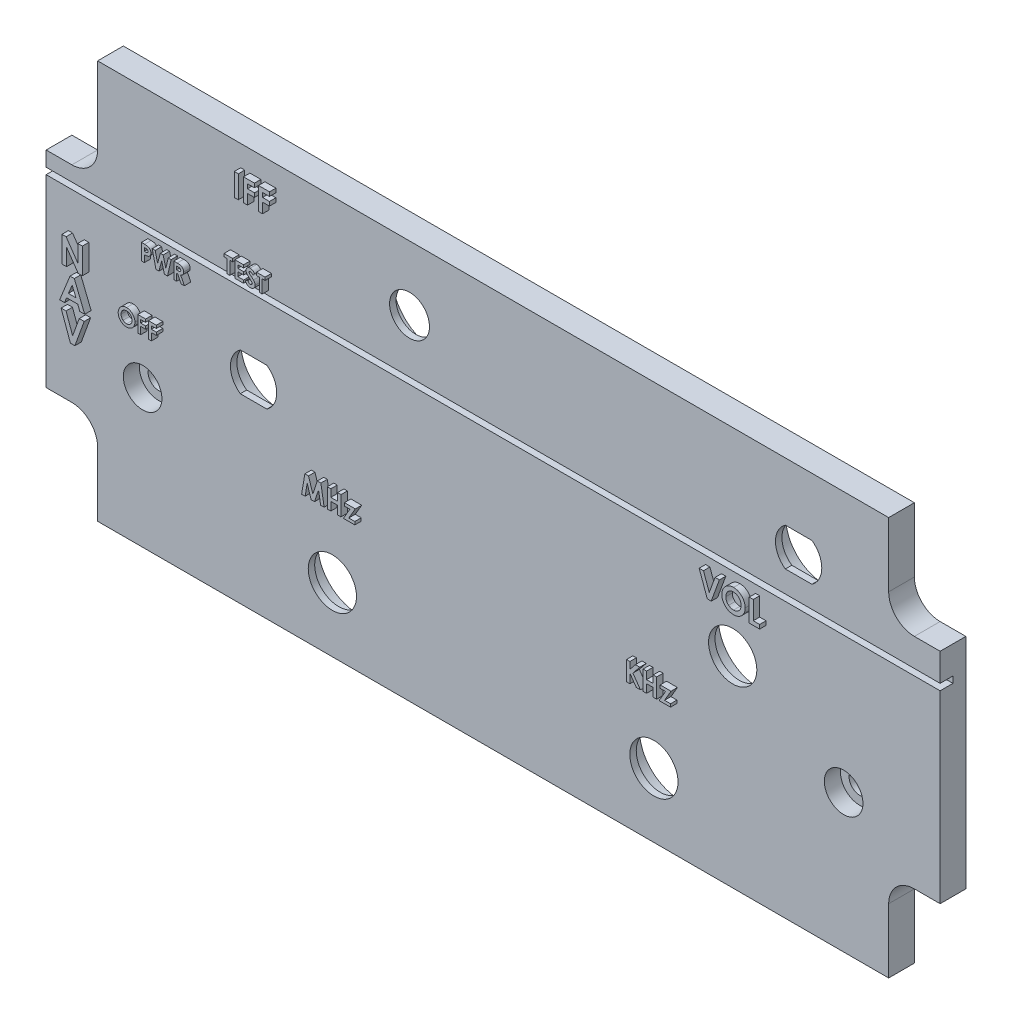
from build123d import *

# Parameters (mm, degrees)
SKETCH1_R           = 1.65
SKETCH1_R_2         = 3.75
SKETCH1_R_3         = 3.1
BOSS_EXTRUDE1_DEPTH = 4
SKETCH2_R           = 6.25
SKETCH2_R_2         = 3.75
SKETCH2_R_3         = 6.75
SKETCH2_R_4         = 3.1
SKETCH2_R_5         = 6
BACK_HOLES_DEPTH    = 3
SKETCH3_R           = 3
CUT_EXTRUDE2_DEPTH  = 2.5
SKETCH5_W           = 139
SKETCH5_H           = 1
CUT_EXTRUDE3_DEPTH  = 2
SKETCH4_W           = 0.628205128
SKETCH4_H           = 3.5
TEXTOS_DEPTH        = 1


with BuildPart() as part:
    # Sketch1 → Boss-Extrude1 (new body)
    with BuildSketch(Plane.XY):
        with BuildLine():
            Line((8, 0), (131, 0))
            Line((131, 0), (131, 10))
            ThreePointArc((131, 10), (132.171572875, 12.828427125), (135, 14))
            Line((135, 14), (139, 14))
            Line((139, 14), (139, 48))
            Line((139, 48), (135, 48))
            ThreePointArc((135, 48), (132.171572875, 49.171572875), (131, 52))
            Line((131, 52), (131, 62))
            Line((131, 62), (8, 62))
            Line((8, 62), (8, 50))
            ThreePointArc((8, 50), (6.828427125, 47.171572875), (4, 46))
            Line((4, 46), (0, 46))
            Line((0, 46), (0, 14))
            Line((0, 14), (4, 14))
            ThreePointArc((4, 14), (6.828427125, 12.828427125), (8, 10))
            Line((8, 10), (8, 0))
        make_face()
        with Locations((15, 21.5)):
            Circle(SKETCH1_R, mode=Mode.SUBTRACT)
        with Locations((124, 21.5)):
            Circle(SKETCH1_R, mode=Mode.SUBTRACT)
        with Locations((106.75, 31.217622393)):
            Circle(SKETCH1_R_2, mode=Mode.SUBTRACT)
        with Locations((94.5, 10)):
            Circle(SKETCH1_R_2, mode=Mode.SUBTRACT)
        with Locations((44.5, 10)):
            Circle(SKETCH1_R_2, mode=Mode.SUBTRACT)
        with Locations((56.5, 52)):
            Circle(SKETCH1_R_3, mode=Mode.SUBTRACT)
        with BuildLine():
            Line((30.186628972, 28.267622393), (34.313371028, 28.267622393))
            ThreePointArc((34.313371028, 28.267622393), (35.85, 31.217622393), (34.313371028, 34.167622393))
            Line((34.313371028, 34.167622393), (30.186628972, 34.167622393))
            ThreePointArc((30.186628972, 34.167622393), (28.65, 31.217622393), (30.186628972, 28.267622393))
        make_face(mode=Mode.SUBTRACT)
        with BuildLine():
            Line((114.936628972, 47.05), (119.063371028, 47.05))
            ThreePointArc((119.063371028, 47.05), (120.6, 50), (119.063371028, 52.95))
            Line((119.063371028, 52.95), (114.936628972, 52.95))
            ThreePointArc((114.936628972, 52.95), (113.4, 50), (114.936628972, 47.05))
        make_face(mode=Mode.SUBTRACT)
    extrude(amount=BOSS_EXTRUDE1_DEPTH)

    # Sketch2 → Back holes (cut)
    # profile 1 of 6: a face of its own
    with BuildSketch(Plane(origin=(0, 0, 0), x_dir=(-1, 0, 0), z_dir=(0, 0, -1))):
        with Locations((-44.5, 10)):
            Circle(SKETCH2_R)
        with Locations((-44.5, 10)):
            Circle(SKETCH2_R_2, mode=Mode.SUBTRACT)
    # profile 2 of 6: a face of its own
    with BuildSketch(Plane(origin=(0, 0, 0), x_dir=(-1, 0, 0), z_dir=(0, 0, -1))):
        with Locations((-94.5, 10)):
            Circle(SKETCH2_R)
        with Locations((-94.5, 10)):
            Circle(SKETCH2_R_2, mode=Mode.SUBTRACT)
    # profile 3 of 6: a face of its own
    with BuildSketch(Plane(origin=(0, 0, 0), x_dir=(-1, 0, 0), z_dir=(0, 0, -1))):
        with Locations((-106.75, 31.217622393)):
            Circle(SKETCH2_R)
        with Locations((-106.75, 31.217622393)):
            Circle(SKETCH2_R_2, mode=Mode.SUBTRACT)
    # profile 4 of 6: a face of its own
    with BuildSketch(Plane(origin=(0, 0, 0), x_dir=(-1, 0, 0), z_dir=(0, 0, -1))):
        with Locations((-56.5, 52)):
            Circle(SKETCH2_R_3)
        with Locations((-56.5, 52)):
            Circle(SKETCH2_R_4, mode=Mode.SUBTRACT)
    # profile 5 of 6: a face of its own
    with BuildSketch(Plane(origin=(0, 0, 0), x_dir=(-1, 0, 0), z_dir=(0, 0, -1))):
        with Locations((-117, 50)):
            Circle(SKETCH2_R_5)
        with BuildLine():
            ThreePointArc((-119.063371028, 47.05), (-120.6, 50), (-119.063371028, 52.95))
            Line((-119.063371028, 52.95), (-114.936628972, 52.95))
            ThreePointArc((-114.936628972, 52.95), (-113.4, 50), (-114.936628972, 47.05))
            Line((-114.936628972, 47.05), (-119.063371028, 47.05))
        make_face(mode=Mode.SUBTRACT)
    # profile 6 of 6: a face of its own
    with BuildSketch(Plane(origin=(0, 0, 0), x_dir=(-1, 0, 0), z_dir=(0, 0, -1))):
        with Locations((-32.25, 31.217622393)):
            Circle(SKETCH2_R_5)
        with BuildLine():
            Line((-34.313371028, 34.167622393), (-30.186628972, 34.167622393))
            ThreePointArc((-30.186628972, 34.167622393), (-28.65, 31.217622393), (-30.186628972, 28.267622393))
            Line((-30.186628972, 28.267622393), (-34.313371028, 28.267622393))
            ThreePointArc((-34.313371028, 28.267622393), (-35.85, 31.217622393), (-34.313371028, 34.167622393))
        make_face(mode=Mode.SUBTRACT)
    extrude(amount=-BACK_HOLES_DEPTH, mode=Mode.SUBTRACT)

    # Sketch3 → Cut-Extrude2 (cut)
    with BuildSketch(Plane.XY.offset(4)):
        with Locations((15, 21.5)):
            Circle(SKETCH3_R)
        with Locations((124, 21.5)):
            Circle(SKETCH3_R)
    extrude(amount=-CUT_EXTRUDE2_DEPTH, mode=Mode.SUBTRACT)

    # Sketch5 → Cut-Extrude3 (cut)
    with BuildSketch(Plane.XY.offset(4)):
        with Locations((69.5, 43.174651963)):
            Rectangle(SKETCH5_W, SKETCH5_H)
    extrude(amount=-CUT_EXTRUDE3_DEPTH, mode=Mode.SUBTRACT)

    # Sketch4 → Textos (add)
    # profile 1 of 25: a face of its own
    with BuildSketch(Plane.XY.offset(4)):
        Polygon((3.456317208, 36.872484532), (4.102951824, 36.872484532), (5.91785567, 34.240272994), (5.91785567, 36.872484532), (6.635804388, 36.872484532), (6.635804388, 32.872484532), (5.98436208, 32.872484532), (4.174265926, 35.49668325), (4.174265926, 32.872484532), (3.456317208, 32.872484532), align=None)
    # profile 2 of 25: a face of its own
    with BuildSketch(Plane.XY.offset(4)):
        with BuildLine():
            add(Edge.make_bspline(
                [(13.505282568, 32.032467925), (13.548748132, 32.031342524), (13.634559, 32.029120727), (13.760755821, 32.010600314), (13.882369792, 31.980423958), (13.999345918, 31.938476639), (14.111391307, 31.883622212), (14.218901178, 31.817415836), (14.321490437, 31.738607905), (14.418107832, 31.649036877), (14.50739973, 31.551632296), (14.584771211, 31.446758948), (14.650750772, 31.337134205), (14.705434809, 31.222464326), (14.747086881, 31.101955167), (14.776315863, 30.976221165), (14.795094036, 30.845298091), (14.797253815, 30.756157323), (14.798351479, 30.710853342)],
                knots=[0, 0, 0, 0, 1.014329547, 2.002516266, 2.970391464, 3.935626869, 4.897733899, 5.877609409, 6.878433252, 7.912639331, 8.949961323, 9.958554974, 10.949718813, 11.932905612, 12.9188844, 13.919928257, 14.942845884, 16, 16, 16, 16], degree=3))
            add(Edge.make_bspline(
                [(14.798351479, 30.710853342), (14.797182514, 30.666059832), (14.794879033, 30.577792784), (14.777082471, 30.448076218), (14.747361269, 30.323689089), (14.706415648, 30.204349845), (14.652723373, 30.090636525), (14.588030485, 29.981823084), (14.510629863, 29.878919337), (14.423344609, 29.781980506), (14.32725112, 29.693987717), (14.225472861, 29.616444223), (14.11847978, 29.550736793), (14.006428482, 29.496895523), (13.889078677, 29.455111296), (13.766720235, 29.425629488), (13.639360726, 29.407712798), (13.552750083, 29.405424363), (13.508788177, 29.404262797)],
                knots=[0, 0, 0, 0, 1.051557043, 2.072126891, 3.067553643, 4.050577992, 5.02905126, 6.015227836, 7.017913613, 8.04756643, 9.074058332, 10.072836633, 11.047628519, 12.017157415, 12.98668631, 13.966869689, 14.968021931, 16, 16, 16, 16], degree=3))
            add(Edge.make_bspline(
                [(13.508788177, 29.404262797), (13.462809295, 29.405304779), (13.372467076, 29.407352131), (13.240250834, 29.426821516), (13.11357625, 29.456149212), (12.993507463, 29.499919224), (12.878821675, 29.554635419), (12.770361516, 29.622021694), (12.668163437, 29.701966688), (12.572813661, 29.792422979), (12.486426534, 29.891402002), (12.410172949, 29.995964563), (12.345851359, 30.105311894), (12.293459409, 30.219495175), (12.252155701, 30.337804782), (12.223020628, 30.460961255), (12.205809845, 30.588669222), (12.203412483, 30.675411026), (12.202197633, 30.719366963)],
                knots=[0, 0, 0, 0, 1.067978421, 2.098431617, 3.099715153, 4.085208694, 5.062210972, 6.048429807, 7.046490867, 8.072918869, 9.098532598, 10.095778865, 11.076610158, 12.041847152, 13.011192615, 13.984257998, 14.978533688, 16, 16, 16, 16], degree=3))
            add(Edge.make_bspline(
                [(12.202197633, 30.719366963), (12.202578923, 30.748938217), (12.203336675, 30.807706285), (12.212464595, 30.894797562), (12.225606177, 30.980188934), (12.245041952, 31.063539945), (12.268651452, 31.145438597), (12.299240894, 31.225122557), (12.334059957, 31.303443069), (12.374742754, 31.37947507), (12.419978091, 31.452519002), (12.46933387, 31.522230303), (12.522934198, 31.587766063), (12.580606408, 31.649556956), (12.642549247, 31.707196824), (12.707947922, 31.761501641), (12.778070786, 31.811028879), (12.851383068, 31.85698809), (12.927471453, 31.898548207), (13.00602619, 31.933922936), (13.085428897, 31.964815084), (13.166740287, 31.989196534), (13.249088964, 32.009054969), (13.333354657, 32.022187693), (13.418776072, 32.031315361), (13.476378637, 32.032082825), (13.505282568, 32.032467925)],
                knots=[0, 0, 0, 0, 1.034744296, 2.056386356, 3.06226378, 4.057406941, 5.050368692, 6.043467995, 7.042652155, 8.049140477, 9.059438543, 10.048523776, 11.036952808, 12.020949711, 13.004946614, 13.997082645, 14.994316842, 16.007702937, 17.024872941, 18.026463647, 19.021641123, 20.005082605, 20.995858141, 21.984425357, 22.988620895, 24, 24, 24, 24], degree=3))
        make_face()
        with BuildLine():
            add(Edge.make_bspline(
                [(13.49827135, 31.583749976), (13.469019032, 31.582965071), (13.41128666, 31.581415982), (13.326603785, 31.569614018), (13.245305235, 31.550764939), (13.167841678, 31.52346228), (13.093877383, 31.488712924), (13.023281232, 31.44663829), (12.957030837, 31.395792109), (12.894242813, 31.338904086), (12.837524165, 31.275517755), (12.78741145, 31.207588522), (12.745475179, 31.135229826), (12.710353289, 31.059113864), (12.68391429, 30.978384731), (12.665082584, 30.893674787), (12.653181649, 30.804838074), (12.651681521, 30.744278202), (12.650915581, 30.713357348)],
                knots=[0, 0, 0, 0, 1.033739768, 2.040188636, 3.016340934, 3.979330865, 4.937572243, 5.900995986, 6.878200029, 7.884839167, 8.891893314, 9.879764717, 10.863503415, 11.843163062, 12.837761627, 13.859916423, 14.907309254, 16, 16, 16, 16], degree=3))
            add(Edge.make_bspline(
                [(12.650915581, 30.713357348), (12.651931101, 30.679090086), (12.653921351, 30.611931931), (12.667924992, 30.513963424), (12.691883827, 30.421441892), (12.72647992, 30.334819845), (12.769388152, 30.253135409), (12.822673366, 30.177389744), (12.885472594, 30.10712932), (12.93385261, 30.066108357), (12.958407568, 30.045288438)],
                knots=[0, 0, 0, 0, 1.078454662, 2.113592447, 3.107694534, 4.079536787, 5.043276885, 6.005368276, 6.987637804, 8, 8, 8, 8], degree=3))
            add(Edge.make_bspline(
                [(12.958407568, 30.045288438), (12.978522767, 30.029907481), (13.018299966, 29.999492103), (13.081793036, 29.960508557), (13.147178396, 29.927095769), (13.21494946, 29.900098631), (13.284963099, 29.878863137), (13.357209712, 29.863992269), (13.431586932, 29.854659513), (13.481884294, 29.853544072), (13.507285774, 29.852980745)],
                knots=[0, 0, 0, 0, 1.023928204, 2.024787132, 3.009472467, 3.9914905, 4.972207045, 5.96565515, 6.972602802, 8, 8, 8, 8], degree=3))
            add(Edge.make_bspline(
                [(13.507285774, 29.852980745), (13.536035098, 29.853772306), (13.592600298, 29.855329726), (13.675706756, 29.866986402), (13.755325266, 29.886713705), (13.831950108, 29.913776856), (13.905360329, 29.94896252), (13.975197155, 29.992342178), (14.041583027, 30.043383182), (14.10429106, 30.101018269), (14.161609167, 30.164654298), (14.211617307, 30.232945859), (14.254886942, 30.304388285), (14.289278471, 30.379992734), (14.316762015, 30.459045536), (14.335367071, 30.541896798), (14.347368543, 30.628204977), (14.348869093, 30.686940743), (14.34963353, 30.716862957)],
                knots=[0, 0, 0, 0, 1.026359118, 2.019393844, 2.989460624, 3.950973911, 4.916101784, 5.890408035, 6.881132271, 7.902007068, 8.92769091, 9.933912415, 10.920395702, 11.90457117, 12.894218921, 13.903490204, 14.931958862, 16, 16, 16, 16], degree=3))
            add(Edge.make_bspline(
                [(14.34963353, 30.716862957), (14.348842643, 30.74661311), (14.347285904, 30.805171748), (14.335608712, 30.89125803), (14.316006514, 30.973743528), (14.288862095, 31.052762952), (14.25420011, 31.128393769), (14.211337049, 31.200370016), (14.160423313, 31.26862211), (14.102630679, 31.332684939), (14.039726949, 31.391554576), (13.972193509, 31.442642719), (13.901920022, 31.487036692), (13.827294069, 31.521813137), (13.749842437, 31.549519457), (13.66909251, 31.569922789), (13.584738444, 31.581333072), (13.527350629, 31.58293716), (13.49827135, 31.583749976)],
                knots=[0, 0, 0, 0, 1.055025985, 2.07665775, 3.074803781, 4.057872707, 5.035505728, 6.020516407, 7.023567878, 8.050795229, 9.077271434, 10.074415901, 11.050397877, 12.019801805, 12.988065821, 13.964604439, 14.968634123, 16, 16, 16, 16], degree=3))
        make_face(mode=Mode.SUBTRACT)
    # profile 3 of 25: a face of its own
    with BuildSketch(Plane.XY.offset(4)):
        Polygon((15.247069427, 31.968365361), (16.465018145, 31.968365361), (16.465018145, 31.519647412), (15.695787376, 31.519647412), (15.695787376, 31.038878181), (16.465018145, 31.038878181), (16.465018145, 30.590160233), (15.695787376, 30.590160233), (15.695787376, 29.468365361), (15.247069427, 29.468365361), align=None)
    # profile 4 of 25: a face of its own
    with BuildSketch(Plane.XY.offset(4)):
        Polygon((16.913736094, 31.968365361), (18.131684812, 31.968365361), (18.131684812, 31.519647412), (17.362454043, 31.519647412), (17.362454043, 31.038878181), (18.131684812, 31.038878181), (18.131684812, 30.590160233), (17.362454043, 30.590160233), (17.362454043, 29.468365361), (16.913736094, 29.468365361), align=None)
    # profile 5 of 25: a face of its own
    with BuildSketch(Plane.XY.offset(4)):
        with BuildLine():
            Line((15.809110504, 41.959185567), (16.309911786, 41.959185567))
            add(Edge.make_bspline(
                [(16.309911786, 41.959185567), (16.342633492, 41.959039097), (16.405760522, 41.958756527), (16.496794893, 41.95532999), (16.580778558, 41.949189426), (16.657692221, 41.941600661), (16.727504257, 41.930961506), (16.790302092, 41.918764549), (16.846098759, 41.903905105), (16.895523446, 41.886267152), (16.939880507, 41.865472693), (16.981856593, 41.84332511), (17.020503041, 41.816892752), (17.057770452, 41.789024384), (17.091528184, 41.757057754), (17.123882248, 41.723120286), (17.153462361, 41.685866048), (17.180405585, 41.645745993), (17.204847241, 41.603501368), (17.226201107, 41.559056652), (17.243522167, 41.512341517), (17.258052382, 41.463658155), (17.269723193, 41.413008689), (17.277491656, 41.360081619), (17.282768387, 41.305246504), (17.283233985, 41.267925689), (17.283469479, 41.249049349)],
                knots=[0, 0, 0, 0, 1.698747864, 3.27724071, 4.728299578, 6.070144658, 7.288476769, 8.393259625, 9.389771311, 10.283485332, 11.113357557, 11.931608583, 12.74405601, 13.541433047, 14.344816069, 15.154114104, 15.974336324, 16.810834471, 17.661136416, 18.50621059, 19.367396281, 20.244825668, 21.142564693, 22.063065223, 23.020325768, 24, 24, 24, 24], degree=3))
            add(Edge.make_bspline(
                [(17.283469479, 41.249049349), (17.28312875, 41.228166903), (17.282459175, 41.187130331), (17.275895185, 41.12697575), (17.264681815, 41.069623804), (17.250026528, 41.014590833), (17.229590773, 40.962782251), (17.206243882, 40.91296189), (17.177519801, 40.86652656), (17.144697946, 40.822895411), (17.108852736, 40.7817137), (17.069133207, 40.744170473), (17.02629643, 40.710009797), (16.980590373, 40.678873667), (16.931843441, 40.650824891), (16.880090807, 40.625600822), (16.824979075, 40.604008204), (16.786600923, 40.592715439), (16.767143357, 40.586990054)],
                knots=[0, 0, 0, 0, 1.102006807, 2.165578795, 3.188629044, 4.184801286, 5.166646146, 6.124351954, 7.085497154, 8.042432466, 9.003981491, 9.963833307, 10.922997304, 11.89326795, 12.880200226, 13.889073926, 14.929769137, 16, 16, 16, 16], degree=3))
            add(Edge.make_bspline(
                [(16.767143357, 40.586990054), (16.754327485, 40.583801444), (16.726564179, 40.576893889), (16.680623533, 40.569880986), (16.627681763, 40.563433054), (16.567567672, 40.557891836), (16.500246604, 40.554125099), (16.425783742, 40.551183445), (16.344145342, 40.549044559), (16.287377227, 40.548968662), (16.257828453, 40.548929157)],
                knots=[0, 0, 0, 0, 0.618981996, 1.340914327, 2.176866532, 3.120127938, 4.170906482, 5.338178032, 6.614476169, 8, 8, 8, 8], degree=3))
            Line((16.257828453, 40.548929157), (16.257828453, 39.459185567))
            Line((16.257828453, 39.459185567), (15.809110504, 39.459185567))
            Line((15.809110504, 39.459185567), (15.809110504, 41.959185567))
        make_face()
        with BuildLine():
            Line((16.257828453, 40.997647105), (16.416582459, 40.997647105))
            add(Edge.make_bspline(
                [(16.416582459, 40.997647105), (16.445470257, 40.997830276), (16.498624234, 40.998167314), (16.571213797, 41.003041072), (16.629548166, 41.010484284), (16.6756334, 41.021159572), (16.712022058, 41.037360736), (16.743404997, 41.056102431), (16.770322945, 41.07980079), (16.793629926, 41.10688022), (16.812263155, 41.137995842), (16.825184329, 41.172640999), (16.833577669, 41.210087759), (16.834352872, 41.236148226), (16.83475153, 41.24955015)],
                knots=[0, 0, 0, 0, 1.8619151, 3.425951444, 4.686033666, 5.651700536, 6.461346321, 7.243864085, 7.999046032, 8.762387399, 9.539336099, 10.322741239, 11.137448474, 12, 12, 12, 12], degree=3))
            add(Edge.make_bspline(
                [(16.83475153, 41.24955015), (16.834356973, 41.261259237), (16.833591437, 41.283977681), (16.827967603, 41.31676603), (16.819004829, 41.347331536), (16.806018113, 41.375354981), (16.789229366, 41.40078875), (16.768760485, 41.423622824), (16.744874127, 41.444346212), (16.726432462, 41.455315419), (16.717063229, 41.460888291)],
                knots=[0, 0, 0, 0, 1.102301479, 2.1387299, 3.123554645, 4.094223062, 5.036071848, 5.982632524, 6.975082478, 8, 8, 8, 8], degree=3))
            add(Edge.make_bspline(
                [(16.717063229, 41.460888291), (16.709126948, 41.464901896), (16.692324214, 41.47339952), (16.66370753, 41.483278629), (16.630684314, 41.491612746), (16.593031622, 41.498529983), (16.55089966, 41.503898477), (16.504295947, 41.508004032), (16.4531519, 41.509655035), (16.417584276, 41.510189286), (16.399054415, 41.510467618)],
                knots=[0, 0, 0, 0, 0.656809284, 1.390599849, 2.23162475, 3.173112763, 4.218524733, 5.370385145, 6.63003504, 8, 8, 8, 8], degree=3))
            Line((16.399054415, 41.510467618), (16.257828453, 41.510467618))
            Line((16.257828453, 41.510467618), (16.257828453, 40.997647105))
        make_face(mode=Mode.SUBTRACT)
    # profile 6 of 25: a face of its own
    with BuildSketch(Plane.XY.offset(4)):
        Polygon((17.491802812, 41.959185567), (17.955043998, 41.959185567), (18.325136145, 40.363131881), (18.749314831, 41.959185567), (19.184511145, 41.959185567), (19.607187427, 40.363131881), (19.97527637, 41.959185567), (20.440520761, 41.959185567), (19.862596081, 39.459185567), (19.393846081, 39.459185567), (18.966161786, 41.075271304), (18.536474286, 39.459185567), (18.071229895, 39.459185567), align=None)
    # profile 7 of 25: a face of its own
    with BuildSketch(Plane.XY.offset(4)):
        with BuildLine():
            Line((20.841161786, 41.959185567), (21.363998325, 41.959185567))
            add(Edge.make_bspline(
                [(21.363998325, 41.959185567), (21.398557661, 41.959062901), (21.465024999, 41.95882698), (21.56086727, 41.955104773), (21.648911577, 41.949925017), (21.729288276, 41.942020571), (21.801962982, 41.931540231), (21.867008531, 41.919185645), (21.924423023, 41.905104945), (21.974690669, 41.887559282), (22.020054733, 41.867768041), (22.062340348, 41.845027541), (22.102480397, 41.819591006), (22.140206588, 41.790789132), (22.175846768, 41.759140057), (22.209468177, 41.724611923), (22.240595712, 41.686911947), (22.26903663, 41.646278343), (22.294958237, 41.603532724), (22.317867502, 41.558616399), (22.336497353, 41.511498133), (22.352958825, 41.462858885), (22.364815489, 41.412003348), (22.373061626, 41.35942661), (22.379099124, 41.304943595), (22.379446251, 41.267930254), (22.379623325, 41.249049349)],
                knots=[0, 0, 0, 0, 1.749336639, 3.364467119, 4.854658419, 6.213483162, 7.451590619, 8.570285859, 9.5643256, 10.440900261, 11.26203566, 12.067320669, 12.869050712, 13.665104639, 14.467235401, 15.27997916, 16.102287765, 16.939272006, 17.78853747, 18.631303466, 19.488103222, 20.351255419, 21.228522269, 22.127379805, 23.044756219, 24, 24, 24, 24], degree=3))
            add(Edge.make_bspline(
                [(22.379623325, 41.249049349), (22.379163352, 41.229342021), (22.378261429, 41.190699544), (22.37340318, 41.133936896), (22.364523827, 41.079630365), (22.351074755, 41.027938953), (22.335616794, 40.978219302), (22.315061671, 40.931388768), (22.291863182, 40.886766271), (22.264311016, 40.844983012), (22.234073859, 40.805110902), (22.198908682, 40.768677589), (22.161093647, 40.73372492), (22.118503035, 40.702442212), (22.073014278, 40.672714242), (22.023723564, 40.645772783), (21.970952579, 40.620940591), (21.933851964, 40.607092446), (21.914879735, 40.600010887)],
                knots=[0, 0, 0, 0, 1.099860209, 2.156625411, 3.176576793, 4.16617041, 5.135385252, 6.078461593, 7.016046972, 7.938469504, 8.868247731, 9.803980173, 10.76021508, 11.73834243, 12.748633912, 13.790971185, 14.870363756, 16, 16, 16, 16], degree=3))
            Line((21.914879735, 40.600010887), (22.491802812, 39.459185567))
            Line((22.491802812, 39.459185567), (21.993004735, 39.459185567))
            Line((21.993004735, 39.459185567), (21.442123325, 40.548929157))
            Line((21.442123325, 40.548929157), (21.289879735, 40.548929157))
            Line((21.289879735, 40.548929157), (21.289879735, 39.459185567))
            Line((21.289879735, 39.459185567), (20.841161786, 39.459185567))
            Line((20.841161786, 39.459185567), (20.841161786, 41.959185567))
        make_face()
        with BuildLine():
            Line((21.289879735, 40.997647105), (21.464659383, 40.997647105))
            add(Edge.make_bspline(
                [(21.464659383, 40.997647105), (21.486027647, 40.997887769), (21.526943283, 40.998348588), (21.585785341, 41.00048606), (21.639227962, 41.005636309), (21.687500648, 41.012143457), (21.730846302, 41.0196569), (21.768878297, 41.030424118), (21.802182647, 41.041961466), (21.830364694, 41.056299396), (21.854442787, 41.072604732), (21.87523268, 41.091127999), (21.892428902, 41.112566322), (21.90658227, 41.1363371), (21.917592051, 41.16265058), (21.925628348, 41.191217899), (21.93011945, 41.222364475), (21.930636166, 41.243859854), (21.930905376, 41.255058964)],
                knots=[0, 0, 0, 0, 1.688639943, 3.233382647, 4.650958383, 5.928841754, 7.082724185, 8.122798841, 9.049171256, 9.863274652, 10.613301712, 11.341792392, 12.054588806, 12.776240173, 13.521029143, 14.301969904, 15.115324896, 16, 16, 16, 16], degree=3))
            add(Edge.make_bspline(
                [(21.930905376, 41.255058964), (21.93039641, 41.268308329), (21.929396642, 41.294334252), (21.919475829, 41.331802454), (21.903684039, 41.366481839), (21.882037819, 41.398215717), (21.85477722, 41.426035824), (21.823493532, 41.450559471), (21.787511576, 41.469950935), (21.754194994, 41.482741339), (21.723884691, 41.490393969), (21.696530599, 41.496096642), (21.664854395, 41.500138289), (21.628832167, 41.504425176), (21.588555736, 41.507205005), (21.54380557, 41.509233726), (21.494710194, 41.510063776), (21.460486053, 41.510329128), (21.442624126, 41.510467618)],
                knots=[0, 0, 0, 0, 1.020303359, 2.004196876, 2.966617323, 3.9489082, 4.950758222, 5.960522915, 7.003732012, 8.091992268, 8.70421221, 9.413913587, 10.24622431, 11.166358409, 12.212345909, 13.359657661, 14.621978493, 16, 16, 16, 16], degree=3))
            Line((21.442624126, 41.510467618), (21.289879735, 41.510467618))
            Line((21.289879735, 41.510467618), (21.289879735, 40.997647105))
        make_face(mode=Mode.SUBTRACT)
    # profile 8 of 25: a face of its own
    with BuildSketch(Plane.XY.offset(4)):
        Polygon((28.65495004, 46.89105195), (30.001103887, 46.89105195), (30.001103887, 46.442334002), (29.552385938, 46.442334002), (29.552385938, 44.39105195), (29.103667989, 44.39105195), (29.103667989, 46.442334002), (28.65495004, 46.442334002), align=None)
    # profile 9 of 25: a face of its own
    with BuildSketch(Plane.XY.offset(4)):
        Polygon((30.353667989, 46.89105195), (31.699821835, 46.89105195), (31.699821835, 46.442334002), (30.802385938, 46.442334002), (30.802385938, 45.961564771), (31.699821835, 45.961564771), (31.699821835, 45.512846822), (30.802385938, 45.512846822), (30.802385938, 44.839769899), (31.699821835, 44.839769899), (31.699821835, 44.39105195), (30.353667989, 44.39105195), align=None)
    # profile 10 of 25: a face of its own
    with BuildSketch(Plane.XY.offset(4)):
        with BuildLine():
            Line((33.430591066, 46.557017495), (33.095054207, 46.250026309))
            add(Edge.make_bspline(
                [(33.095054207, 46.250026309), (33.080681247, 46.270300864), (33.053087167, 46.309225182), (33.008360043, 46.36134576), (32.963834884, 46.405808493), (32.919099193, 46.442427634), (32.873756449, 46.470980696), (32.827885361, 46.491196579), (32.781745984, 46.504048008), (32.750747445, 46.50564832), (32.735478887, 46.506436566)],
                knots=[0, 0, 0, 0, 1.299362458, 2.494594718, 3.587462134, 4.587049575, 5.512617175, 6.380583204, 7.202344345, 8, 8, 8, 8], degree=3))
            add(Edge.make_bspline(
                [(32.735478887, 46.506436566), (32.721236813, 46.505937097), (32.693739112, 46.504972755), (32.654539098, 46.495387263), (32.619736767, 46.478844111), (32.589366086, 46.457212548), (32.565308025, 46.431151531), (32.546099529, 46.403820224), (32.535283532, 46.373652642), (32.533859934, 46.35293233), (32.533155169, 46.342674546)],
                knots=[0, 0, 0, 0, 1.185010067, 2.2879431, 3.333075148, 4.379039566, 5.372662701, 6.27520591, 7.14612461, 8, 8, 8, 8], degree=3))
            add(Edge.make_bspline(
                [(32.533155169, 46.342674546), (32.533596809, 46.332268841), (32.534486213, 46.311313196), (32.543076637, 46.28060009), (32.556024859, 46.250589809), (32.568397414, 46.232321123), (32.574721675, 46.22298304)],
                knots=[0, 0, 0, 0, 0.967525499, 1.948461899, 2.951351359, 4, 4, 4, 4], degree=3))
            add(Edge.make_bspline(
                [(32.574721675, 46.22298304), (32.580471113, 46.215724646), (32.593705559, 46.199016781), (32.618940937, 46.172554128), (32.650631271, 46.140135062), (32.689996074, 46.10287438), (32.735401203, 46.05943204), (32.788951245, 46.01151578), (32.849104796, 45.957641687), (32.891860546, 45.920125719), (32.914264944, 45.900467014)],
                knots=[0, 0, 0, 0, 0.473873513, 1.090794244, 1.870441696, 2.795289791, 3.865433203, 5.087734844, 6.473946851, 8, 8, 8, 8], degree=3))
            add(Edge.make_bspline(
                [(32.914264944, 45.900467014), (32.935294695, 45.882266826), (32.975204792, 45.84772665), (33.031988934, 45.798702416), (33.081892738, 45.754596508), (33.125643189, 45.716070862), (33.16257707, 45.682721254), (33.192849654, 45.654388275), (33.216830669, 45.631623515), (33.230462471, 45.617873587), (33.236280169, 45.612005476)],
                knots=[0, 0, 0, 0, 1.543621617, 2.929473131, 4.163658386, 5.240097082, 6.164993805, 6.925417477, 7.541396219, 8, 8, 8, 8], degree=3))
            add(Edge.make_bspline(
                [(33.236280169, 45.612005476), (33.2583513, 45.588119784), (33.300779767, 45.542203097), (33.355921816, 45.471046672), (33.401305506, 45.401583492), (33.436415189, 45.332506495), (33.462931434, 45.262819037), (33.481625738, 45.190812037), (33.492821881, 45.115733067), (33.494064914, 45.064500835), (33.49469363, 45.038588008)],
                knots=[0, 0, 0, 0, 1.206664779, 2.319633467, 3.337109185, 4.282041471, 5.190008762, 6.099243693, 7.03861361, 8, 8, 8, 8], degree=3))
            add(Edge.make_bspline(
                [(33.49469363, 45.038588008), (33.494246126, 45.013339136), (33.493368107, 44.963799908), (33.482614059, 44.891306628), (33.467279417, 44.821927412), (33.443569371, 44.756417206), (33.414671707, 44.693700678), (33.378444312, 44.634754752), (33.335900203, 44.578982873), (33.287138123, 44.52738203), (33.233201471, 44.480557842), (33.175349287, 44.438873843), (33.113015861, 44.404458393), (33.046733761, 44.376119724), (32.976538467, 44.354292903), (32.902513601, 44.338160848), (32.824545938, 44.328478643), (32.771230527, 44.327466483), (32.743992508, 44.326949386)],
                knots=[0, 0, 0, 0, 1.043214005, 2.046824704, 3.02475056, 3.976699089, 4.921714032, 5.875962561, 6.831408892, 7.817874052, 8.806269674, 9.781291748, 10.760897367, 11.74438705, 12.757449933, 13.795994037, 14.874007457, 16, 16, 16, 16], degree=3))
            add(Edge.make_bspline(
                [(32.743992508, 44.326949386), (32.722610896, 44.32732871), (32.68026304, 44.328079989), (32.617848703, 44.334213558), (32.557580606, 44.344112486), (32.499526634, 44.358300607), (32.443425244, 44.37627888), (32.389274133, 44.398238653), (32.337447123, 44.424520292), (32.287552066, 44.454583343), (32.239831515, 44.489490505), (32.193682062, 44.528528114), (32.149562106, 44.572296584), (32.107259749, 44.620692404), (32.067045652, 44.673852622), (32.027603465, 44.73103688), (31.990686117, 44.793306443), (31.967880629, 44.836989046), (31.956232092, 44.859301149)],
                knots=[0, 0, 0, 0, 1.016823716, 2.013894106, 2.979844003, 3.91962641, 4.853723003, 5.779685073, 6.695824784, 7.614987388, 8.547259901, 9.504950863, 10.487499108, 11.500346958, 12.559593716, 13.656357062, 14.802919212, 16, 16, 16, 16], degree=3))
            Line((31.956232092, 44.859301149), (32.350863502, 45.096180155))
            add(Edge.make_bspline(
                [(32.350863502, 45.096180155), (32.365434081, 45.070853003), (32.393367126, 45.022298686), (32.440702283, 44.957059808), (32.489194734, 44.901193509), (32.539965582, 44.855687227), (32.592397473, 44.819932487), (32.646743664, 44.794379668), (32.703042338, 44.778562503), (32.741390438, 44.776630862), (32.760518951, 44.775667335)],
                knots=[0, 0, 0, 0, 1.283663364, 2.460892379, 3.537111102, 4.529833553, 5.449777664, 6.316464042, 7.160231139, 8, 8, 8, 8], degree=3))
            add(Edge.make_bspline(
                [(32.760518951, 44.775667335), (32.779975387, 44.776454203), (32.817723707, 44.777980842), (32.871604604, 44.792081947), (32.92100465, 44.814221717), (32.963705685, 44.845812115), (32.99986223, 44.882272236), (33.026547835, 44.922835787), (33.043311912, 44.96672457), (33.045084281, 44.997212606), (33.045975681, 45.012546341)],
                knots=[0, 0, 0, 0, 1.13588714, 2.203786484, 3.234766741, 4.283437687, 5.291419208, 6.222934724, 7.106237994, 8, 8, 8, 8], degree=3))
            add(Edge.make_bspline(
                [(33.045975681, 45.012546341), (33.04515251, 45.026811887), (33.043480315, 45.055790976), (33.031163447, 45.098878222), (33.011908425, 45.141945873), (32.989128376, 45.177271125), (32.965946823, 45.206848002), (32.943780031, 45.232475027), (32.916786741, 45.260788403), (32.885035397, 45.291823747), (32.848945518, 45.32585427), (32.808486702, 45.36287664), (32.763195652, 45.402564734), (32.731183849, 45.429599872), (32.714445233, 45.443736245)],
                knots=[0, 0, 0, 0, 0.916159276, 1.861089862, 2.860218735, 3.940849679, 4.552606315, 5.27541173, 6.11797699, 7.06649574, 8.129236253, 9.306560635, 10.591630461, 12, 12, 12, 12], degree=3))
            add(Edge.make_bspline(
                [(32.714445233, 45.443736245), (32.682624457, 45.470659673), (32.621550756, 45.52233388), (32.535245869, 45.598655057), (32.457477437, 45.669984191), (32.388917154, 45.737203064), (32.328691455, 45.799070301), (32.277208214, 45.856088411), (32.235032998, 45.90869721), (32.190652677, 45.971008812), (32.1484825, 46.04693978), (32.112035499, 46.138293538), (32.088390224, 46.229635704), (32.085741099, 46.290957803), (32.08443722, 46.321140091)],
                knots=[0, 0, 0, 0, 1.345494975, 2.582412109, 3.71882943, 4.751509156, 5.681369928, 6.505683931, 7.230279997, 7.856715994, 8.973648664, 10.023341002, 11.027102913, 12, 12, 12, 12], degree=3))
            add(Edge.make_bspline(
                [(32.08443722, 46.321140091), (32.084979502, 46.34254375), (32.086047855, 46.384711257), (32.095577732, 46.446712432), (32.109820495, 46.506538357), (32.130505077, 46.563970758), (32.157351167, 46.618937701), (32.1899547, 46.67170827), (32.228821948, 46.721796778), (32.272622713, 46.769170019), (32.320879941, 46.812463771), (32.372448921, 46.850674845), (32.42703777, 46.882948473), (32.484312539, 46.909721792), (32.544628137, 46.930215066), (32.607540222, 46.944741721), (32.673139029, 46.953381711), (32.717757921, 46.954556218), (32.740486899, 46.955154514)],
                knots=[0, 0, 0, 0, 1.010766082, 1.991317756, 2.957454644, 3.913069143, 4.869106762, 5.843196583, 6.838735724, 7.860187025, 8.887984031, 9.89767229, 10.887916223, 11.879572884, 12.879850636, 13.892031539, 14.926195476, 16, 16, 16, 16], degree=3))
            add(Edge.make_bspline(
                [(32.740486899, 46.955154514), (32.76994253, 46.954076965), (32.828621278, 46.951930371), (32.9153795, 46.93514471), (33.000121304, 46.908747491), (33.068407838, 46.876902149), (33.122742158, 46.846053552), (33.164384339, 46.817652049), (33.2067575, 46.785116602), (33.250203353, 46.748344682), (33.293914608, 46.706643457), (33.339134185, 46.661005659), (33.385245911, 46.61103687), (33.415211222, 46.575339398), (33.430591066, 46.557017495)],
                knots=[0, 0, 0, 0, 1.282922637, 2.555718331, 3.837320111, 5.142675274, 5.830281639, 6.55870424, 7.337177975, 8.157850921, 9.037902056, 9.96903443, 10.957596896, 12, 12, 12, 12], degree=3))
        make_face()
    # profile 11 of 25: a face of its own
    with BuildSketch(Plane.XY.offset(4)):
        Polygon((33.687001322, 46.89105195), (35.033155169, 46.89105195), (35.033155169, 46.442334002), (34.58443722, 46.442334002), (34.58443722, 44.39105195), (34.135719271, 44.39105195), (34.135719271, 46.442334002), (33.687001322, 46.442334002), align=None)
    # profile 12 of 25: a face of its own
    with BuildSketch(Plane.XY.offset(4)):
        Polygon((102.534407106, 41.447027702), (103.205380664, 41.447027702), (104.104919927, 38.960849818), (105.005160311, 41.447027702), (105.675432747, 41.447027702), (104.40710342, 37.947027702), (103.801334189, 37.947027702), align=None)
    # profile 13 of 25: a face of its own
    with BuildSketch(Plane.XY.offset(4)):
        with BuildLine():
            add(Edge.make_bspline(
                [(107.881161914, 41.536771292), (107.942013703, 41.53519573), (108.062148918, 41.532085214), (108.238824467, 41.506156637), (108.409084026, 41.463909738), (108.572850604, 41.405183492), (108.729714147, 41.328387294), (108.880227967, 41.235698367), (109.02385293, 41.125367264), (109.159117282, 40.999967825), (109.284125939, 40.863601412), (109.392446014, 40.716778724), (109.484817399, 40.563304084), (109.561375051, 40.402766254), (109.619687952, 40.234053431), (109.660608527, 40.058025829), (109.686897969, 39.874733525), (109.689921659, 39.749936449), (109.691458388, 39.686510875)],
                knots=[0, 0, 0, 0, 1.014329547, 2.002516266, 2.970391464, 3.935626869, 4.897733899, 5.877609409, 6.878433252, 7.912639331, 8.949961323, 9.958554974, 10.949718813, 11.932905612, 12.9188844, 13.919928257, 14.942845884, 16, 16, 16, 16], degree=3))
            add(Edge.make_bspline(
                [(109.691458388, 39.686510875), (109.689821838, 39.623799962), (109.686596964, 39.500226095), (109.661681777, 39.318622902), (109.620072095, 39.144480922), (109.562748226, 38.97740598), (109.487579041, 38.818207332), (109.397008998, 38.665868514), (109.288648126, 38.521803269), (109.166448771, 38.386088906), (109.031917887, 38.262899001), (108.889428324, 38.154338109), (108.73963801, 38.062347707), (108.582766193, 37.986969929), (108.418476466, 37.928472012), (108.247174647, 37.887197481), (108.068871334, 37.862114115), (107.947616435, 37.858910305), (107.886069766, 37.857284113)],
                knots=[0, 0, 0, 0, 1.051557043, 2.072126891, 3.067553643, 4.050577992, 5.02905126, 6.015227836, 7.017913613, 8.04756643, 9.074058332, 10.072836633, 11.047628519, 12.017157415, 12.98668631, 13.966869689, 14.968021931, 16, 16, 16, 16], degree=3))
            add(Edge.make_bspline(
                [(107.886069766, 37.857284113), (107.821699331, 37.858742887), (107.695220224, 37.861609181), (107.510117486, 37.88886632), (107.332773068, 37.929925093), (107.164676766, 37.99120311), (107.004116663, 38.067805784), (106.852272441, 38.162146569), (106.709195129, 38.27406956), (106.575705444, 38.400708368), (106.454763465, 38.539279), (106.348008447, 38.685666585), (106.25795822, 38.838752849), (106.184609491, 38.998609441), (106.1267843, 39.164242891), (106.085995197, 39.336661955), (106.061900101, 39.515453108), (106.058543794, 39.636891633), (106.056843004, 39.698429946)],
                knots=[0, 0, 0, 0, 1.067978421, 2.098431617, 3.099715153, 4.085208694, 5.062210972, 6.048429807, 7.046490867, 8.072918869, 9.098532598, 10.095778865, 11.076610158, 12.041847152, 13.011192615, 13.984257998, 14.978533688, 16, 16, 16, 16], degree=3))
            add(Edge.make_bspline(
                [(106.056843004, 39.698429946), (106.05737681, 39.739829701), (106.058437662, 39.822104997), (106.071216751, 39.944032784), (106.089614966, 40.063580705), (106.116825051, 40.18027212), (106.149878351, 40.294930233), (106.19270357, 40.406487777), (106.241450258, 40.516136494), (106.298406174, 40.622581295), (106.361735645, 40.7248428), (106.430833737, 40.822438622), (106.505874195, 40.914188686), (106.586615289, 41.000695935), (106.673335264, 41.081391751), (106.764893409, 41.157418495), (106.863065418, 41.226756627), (106.965702614, 41.291099523), (107.072226352, 41.349283687), (107.182202984, 41.398808308), (107.293366774, 41.442057315), (107.40720272, 41.476191344), (107.522490867, 41.503993154), (107.640462837, 41.522378968), (107.760052819, 41.535157703), (107.84069641, 41.536232153), (107.881161914, 41.536771292)],
                knots=[0, 0, 0, 0, 1.034744296, 2.056386356, 3.06226378, 4.057406941, 5.050368692, 6.043467995, 7.042652155, 8.049140477, 9.059438543, 10.048523776, 11.036952808, 12.020949711, 13.004946614, 13.997082645, 14.994316842, 16.007702937, 17.024872941, 18.026463647, 19.021641123, 20.005082605, 20.995858141, 21.984425357, 22.988620895, 24, 24, 24, 24], degree=3))
        make_face()
        with BuildLine():
            add(Edge.make_bspline(
                [(107.871346209, 40.908566164), (107.830392962, 40.907467296), (107.749567642, 40.905298572), (107.631011617, 40.888775822), (107.517193646, 40.862387112), (107.408744668, 40.824163389), (107.305194654, 40.77551429), (107.206360043, 40.716609803), (107.11360949, 40.64542515), (107.025706256, 40.565781918), (106.946300148, 40.477041054), (106.876142347, 40.381940127), (106.817431568, 40.280637954), (106.768260923, 40.174075607), (106.731246325, 40.06105482), (106.704881936, 39.9424609), (106.688220627, 39.818089501), (106.686120448, 39.73330568), (106.685048132, 39.690016484)],
                knots=[0, 0, 0, 0, 1.033739768, 2.040188636, 3.016340934, 3.979330865, 4.937572243, 5.900995986, 6.878200029, 7.884839167, 8.891893314, 9.879764717, 10.863503415, 11.843163062, 12.837761627, 13.859916423, 14.907309254, 16, 16, 16, 16], degree=3))
            add(Edge.make_bspline(
                [(106.685048132, 39.690016484), (106.686469859, 39.642042318), (106.689256209, 39.548020901), (106.708861306, 39.410864991), (106.742403676, 39.281334846), (106.790838207, 39.16006398), (106.850909731, 39.04570577), (106.92550903, 38.939661839), (107.013427949, 38.841297244), (107.081159972, 38.783867897), (107.115536914, 38.75472001)],
                knots=[0, 0, 0, 0, 1.078454662, 2.113592447, 3.107694534, 4.079536787, 5.043276885, 6.005368276, 6.987637804, 8, 8, 8, 8], degree=3))
            add(Edge.make_bspline(
                [(107.115536914, 38.75472001), (107.143698192, 38.733186671), (107.199386271, 38.690605142), (107.288276569, 38.636028177), (107.379816072, 38.589250273), (107.474695562, 38.551454281), (107.572714656, 38.521724588), (107.673859915, 38.500905374), (107.777988023, 38.487839516), (107.84840433, 38.486277898), (107.883966401, 38.485489241)],
                knots=[0, 0, 0, 0, 1.023928204, 2.024787132, 3.009472467, 3.9914905, 4.972207045, 5.96565515, 6.972602802, 8, 8, 8, 8], degree=3))
            add(Edge.make_bspline(
                [(107.883966401, 38.485489241), (107.924215455, 38.486597426), (108.003406735, 38.488777814), (108.119755776, 38.50509716), (108.23122169, 38.532715385), (108.338496469, 38.570603796), (108.441270779, 38.619863726), (108.539042334, 38.680595246), (108.631982555, 38.752052652), (108.719773802, 38.832741774), (108.800019151, 38.921832215), (108.870030548, 39.0174404), (108.930608036, 39.117459796), (108.978756177, 39.223306024), (109.017233139, 39.333979947), (109.043280218, 39.449971715), (109.060082278, 39.570803165), (109.062183048, 39.653033238), (109.06325326, 39.694924337)],
                knots=[0, 0, 0, 0, 1.026359118, 2.019393844, 2.989460624, 3.950973911, 4.916101784, 5.890408035, 6.881132271, 7.902007068, 8.92769091, 9.933912415, 10.920395702, 11.90457117, 12.894218921, 13.903490204, 14.931958862, 16, 16, 16, 16], degree=3))
            add(Edge.make_bspline(
                [(109.06325326, 39.694924337), (109.062146019, 39.736574551), (109.059966583, 39.818556645), (109.043618515, 39.939077439), (109.016175437, 40.054557137), (108.978173251, 40.16518433), (108.929646472, 40.271067473), (108.869638186, 40.371834219), (108.798358956, 40.467387151), (108.717449268, 40.557075112), (108.629384046, 40.639492604), (108.534837231, 40.711016004), (108.436454348, 40.773167565), (108.331978015, 40.821854589), (108.22354573, 40.860643437), (108.110495832, 40.889208101), (107.99240014, 40.905182498), (107.912057199, 40.907428222), (107.871346209, 40.908566164)],
                knots=[0, 0, 0, 0, 1.055025985, 2.07665775, 3.074803781, 4.057872707, 5.035505728, 6.020516407, 7.023567878, 8.050795229, 9.077271434, 10.074415901, 11.050397877, 12.019801805, 12.988065821, 13.964604439, 14.968634123, 16, 16, 16, 16], degree=3))
        make_face(mode=Mode.SUBTRACT)
    # profile 14 of 25: a face of its own
    with BuildSketch(Plane.XY.offset(4)):
        Polygon((110.319663516, 41.447027702), (110.947868645, 41.447027702), (110.947868645, 38.575232831), (111.935048132, 38.575232831), (111.935048132, 37.947027702), (110.319663516, 37.947027702), align=None)
    # profile 15 of 25: a face of its own
    with BuildSketch(Plane.XY.offset(4)):
        Polygon((41.22688513, 23.506842157), (41.784577438, 23.506842157), (42.470274553, 21.41429408), (43.159577438, 23.506842157), (43.713063015, 23.506842157), (44.220274553, 20.506842157), (43.675202438, 20.506842157), (43.354889938, 22.401673888), (42.731091861, 20.506842157), (42.206452438, 20.506842157), (41.585659169, 22.401673888), (41.26594763, 20.506842157), (40.720274553, 20.506842157), align=None)
    # profile 16 of 25: a face of its own
    with BuildSketch(Plane.XY.offset(4)):
        Polygon((44.720274553, 23.506842157), (45.258736092, 23.506842157), (45.258736092, 22.352996004), (46.29719763, 22.352996004), (46.29719763, 23.506842157), (46.835659169, 23.506842157), (46.835659169, 20.506842157), (46.29719763, 20.506842157), (46.29719763, 21.814534465), (45.258736092, 21.814534465), (45.258736092, 20.506842157), (44.720274553, 20.506842157), align=None)
    # profile 17 of 25: a face of its own
    with BuildSketch(Plane.XY.offset(4)):
        Polygon((47.374120707, 22.69914985), (49.066428399, 22.69914985), (48.058615899, 20.968380619), (48.989505322, 20.968380619), (48.989505322, 20.506842157), (47.220274553, 20.506842157), (48.227486092, 22.237611388), (47.374120707, 22.237611388), align=None)
    # profile 18 of 25: a face of its own
    with BuildSketch(Plane.XY.offset(4)):
        Polygon((91.233249776, 23.506842157), (91.771711314, 23.506842157), (91.771711314, 22.450952734), (92.622672853, 23.506842157), (93.302360353, 23.506842157), (92.233249776, 22.17991908), (93.406326699, 20.506842157), (92.757889199, 20.506842157), (91.771711314, 21.913693119), (91.771711314, 20.506842157), (91.233249776, 20.506842157), align=None)
    # profile 19 of 25: a face of its own
    with BuildSketch(Plane.XY.offset(4)):
        Polygon((93.810172853, 23.506842157), (94.348634391, 23.506842157), (94.348634391, 22.352996004), (95.387095929, 22.352996004), (95.387095929, 23.506842157), (95.925557468, 23.506842157), (95.925557468, 20.506842157), (95.387095929, 20.506842157), (95.387095929, 21.814534465), (94.348634391, 21.814534465), (94.348634391, 20.506842157), (93.810172853, 20.506842157), align=None)
    # profile 20 of 25: a face of its own
    with BuildSketch(Plane.XY.offset(4)):
        Polygon((96.464019006, 22.69914985), (98.156326699, 22.69914985), (97.148514199, 20.968380619), (98.079403622, 20.968380619), (98.079403622, 20.506842157), (96.310172853, 20.506842157), (97.317384391, 22.237611388), (96.464019006, 22.237611388), align=None)
    # profile 21 of 25: a face of its own
    with BuildSketch(Plane.XY.offset(4)):
        Polygon((4.710426012, 31.872484532), (5.377893961, 31.872484532), (6.993278576, 27.872484532), (6.226451653, 27.872484532), (5.915554217, 28.692997353), (4.17436832, 28.692997353), (3.862669602, 27.872484532), (3.095842679, 27.872484532), align=None)
        Polygon((5.044560628, 30.799567866), (4.446804217, 29.410946071), (5.64311832, 29.410946071), align=None, mode=Mode.SUBTRACT)
    # profile 22 of 25: a face of its own
    with BuildSketch(Plane.XY.offset(4)):
        Polygon((3.323179404, 26.872484532), (4.090006327, 26.872484532), (5.118051199, 24.031138379), (6.146897353, 26.872484532), (6.912922994, 26.872484532), (5.463403763, 22.872484532), (4.771096071, 22.872484532), align=None)
    # profile 23 of 25: a face of its own
    with BuildSketch(Plane.XY.offset(4)):
        with Locations((30.560949681, 56.97725354)):
            Rectangle(SKETCH4_W, SKETCH4_H)
    # profile 24 of 25: a face of its own
    with BuildSketch(Plane.XY.offset(4)):
        Polygon((31.682744553, 58.72725354), (33.387872758, 58.72725354), (33.387872758, 58.099048412), (32.310949681, 58.099048412), (32.310949681, 57.425971489), (33.387872758, 57.425971489), (33.387872758, 56.797766361), (32.310949681, 56.797766361), (32.310949681, 55.22725354), (31.682744553, 55.22725354), align=None)
    # profile 25 of 25: a face of its own
    with BuildSketch(Plane.XY.offset(4)):
        Polygon((34.016077886, 58.72725354), (35.721206091, 58.72725354), (35.721206091, 58.099048412), (34.644283014, 58.099048412), (34.644283014, 57.425971489), (35.721206091, 57.425971489), (35.721206091, 56.797766361), (34.644283014, 56.797766361), (34.644283014, 55.22725354), (34.016077886, 55.22725354), align=None)
    extrude(amount=TEXTOS_DEPTH)


solid = part.part
